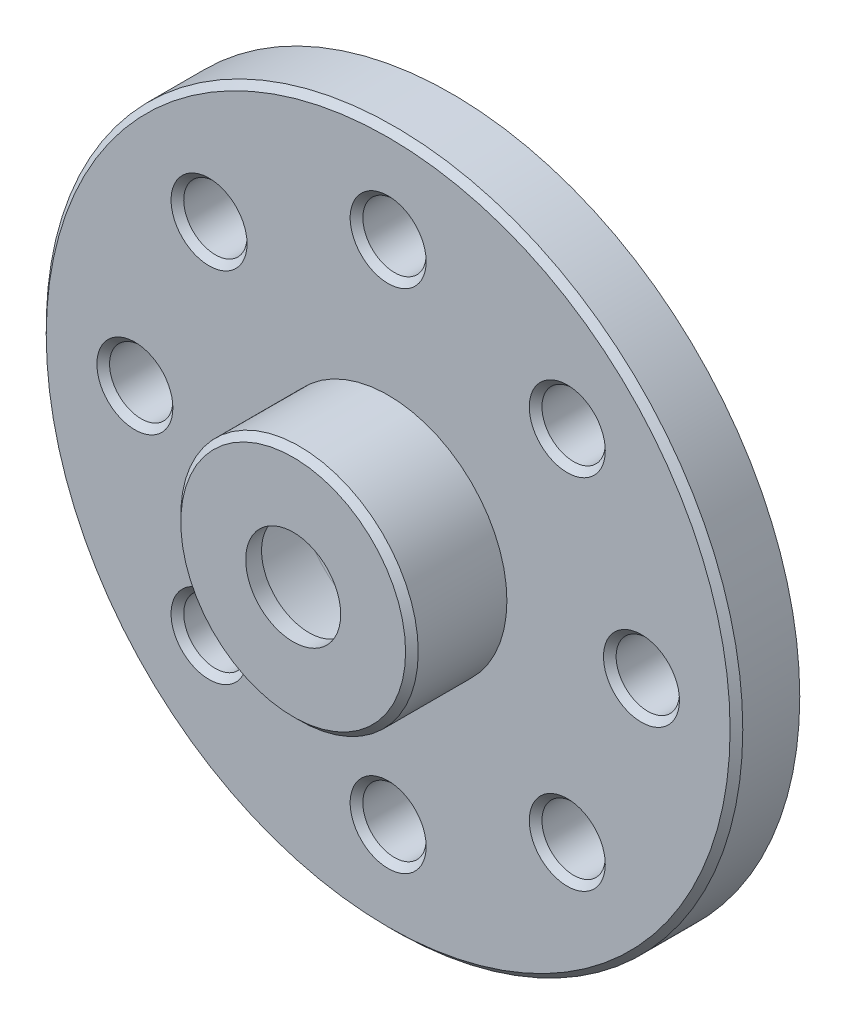
from build123d import *

# Parameters (mm, degrees)
SKETCH1_R           = 11
BOSS_EXTRUDE2_DEPTH = 2
SKETCH2_R           = 3.75
BOSS_EXTRUDE3_DEPTH = 3
SKETCH3_R           = 2.85
CUT_EXTRUDE1_DEPTH  = 4.5
SKETCH4_R           = 1.5
CUT_EXTRUDE2_DEPTH  = 17.340134638
SKETCH6_R           = 1
CUT_EXTRUDE3_DEPTH  = 16.842979518
CIRPATTERN1_COUNT   = 8
CHAMFER1_SIZE       = 0.2
CHAMFER2_SIZE       = 0.2
CHAMFER3_SIZE       = 0.2
CHAMFER4_SIZE       = 0.2
CHAMFER5_SIZE       = 0.2


with BuildPart() as part:
    # Sketch1 → Boss-Extrude2 (new body)
    with BuildSketch(Plane.XY):
        Circle(SKETCH1_R)
    extrude(amount=BOSS_EXTRUDE2_DEPTH)


with BuildPart() as body_2:
    # Sketch2 → Boss-Extrude3 (new body)
    with BuildSketch(Plane.XY.offset(2)):
        Circle(SKETCH2_R)
    extrude(amount=BOSS_EXTRUDE3_DEPTH)


with BuildPart() as cut_extrude1_tool:
    # Sketch3 → Cut-Extrude1 (new body)
    with BuildSketch(Plane(origin=(0, 0, 0), x_dir=(-1, 0, 0), z_dir=(0, 0, -1))):
        Circle(SKETCH3_R)
    extrude(amount=-CUT_EXTRUDE1_DEPTH)


with BuildPart() as part_1:
    add(part.part)

    # Cut-Extrude1: cut by cut_extrude1_tool
    add(cut_extrude1_tool.part, mode=Mode.SUBTRACT)

    # Sketch6 → Cut-Extrude3 (cut, through all)
    with BuildSketch(Plane.XY.offset(2)):
        with Locations((0, 8)):
            Circle(SKETCH6_R)
    cut_extrude3 = extrude(amount=-CUT_EXTRUDE3_DEPTH, mode=Mode.SUBTRACT)

    # CirPattern1: Cut-Extrude3 ×8 about axis
    cirpattern1_axis = Axis((0, 0, 0), (0, 0, 1))
    for i in range(1, CIRPATTERN1_COUNT):
        add(cut_extrude3.rotate(cirpattern1_axis, i * 360 / CIRPATTERN1_COUNT), mode=Mode.SUBTRACT)

    # Chamfer1
    chamfer1_edges = [part_1.edges().sort_by_distance(p)[0] for p in [
        (-11, 0, 2),
    ]]
    chamfer(chamfer1_edges, length=CHAMFER1_SIZE)

    # Chamfer3
    chamfer3_edges = [part_1.edges().sort_by_distance(p)[0] for p in [
        (-1, 8, 2),
    ]]
    chamfer(chamfer3_edges, length=CHAMFER3_SIZE)

    # Chamfer4
    chamfer4_edges = [part_1.edges().sort_by_distance(p)[0] for p in [
        (8, 1, 2),
        (4.949747468, 6.363961031, 2),
    ]]
    chamfer(chamfer4_edges, length=CHAMFER4_SIZE)

    # Chamfer5
    chamfer5_edges = [part_1.edges().sort_by_distance(p)[0] for p in [
        (-6.363961031, 4.949747468, 2),
        (-8, -1, 2),
        (-4.949747468, -6.363961031, 2),
        (1, -8, 2),
        (6.363961031, -4.949747468, 2),
    ]]
    chamfer(chamfer5_edges, length=CHAMFER5_SIZE)


with BuildPart() as body_2_1:
    add(body_2.part)

    # Cut-Extrude1: cut by cut_extrude1_tool
    add(cut_extrude1_tool.part, mode=Mode.SUBTRACT)

    # Sketch4 → Cut-Extrude2 (cut, through all)
    with BuildSketch(Plane.XY.offset(5)):
        Circle(SKETCH4_R)
    extrude(amount=-CUT_EXTRUDE2_DEPTH, mode=Mode.SUBTRACT)

    # Chamfer2
    chamfer2_edges = [body_2_1.edges().sort_by_distance(p)[0] for p in [
        (-3.75, 0, 5),
    ]]
    chamfer(chamfer2_edges, length=CHAMFER2_SIZE)


solid = Compound([part_1.part, body_2_1.part])
